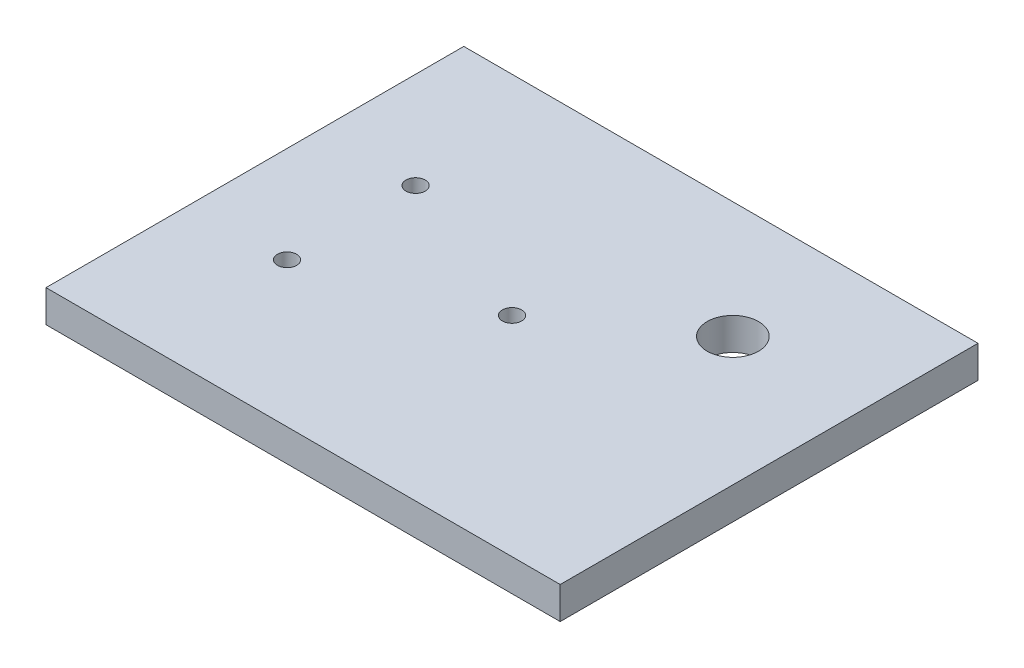
from build123d import *

# Parameters (mm, degrees)
SKETCH1_W           = 80
SKETCH1_H           = 65
SKETCH1_R           = 4
SKETCH1_R_2         = 1.5
BOSS_EXTRUDE1_DEPTH = 5


with BuildPart() as part:
    # Sketch1 → Boss-Extrude1 (new body)
    with BuildSketch(Plane(origin=(0, 0, 0), x_dir=(1, 0, 0), z_dir=(0, 1, 0))):
        with Locations((1.396709306, -0.116075194)):
            Rectangle(SKETCH1_W, SKETCH1_H)
        with Locations(Location((21.396709306, 14.244948454, 0), (0, 0, 270))):
            Circle(SKETCH1_R, mode=Mode.SUBTRACT)
        with Locations(Location((-23.603290694, 9.883924806, 0), (0, 0, 270))):
            Circle(SKETCH1_R_2, mode=Mode.SUBTRACT)
        with Locations(Location((-23.603290694, -10.116075194, 0), (0, 0, 90))):
            Circle(SKETCH1_R_2, mode=Mode.SUBTRACT)
        with Locations(Location((1.396709306, -0.116075194, 0), (0, 0, 270))):
            Circle(SKETCH1_R_2, mode=Mode.SUBTRACT)
    extrude(amount=BOSS_EXTRUDE1_DEPTH)


solid = part.part
